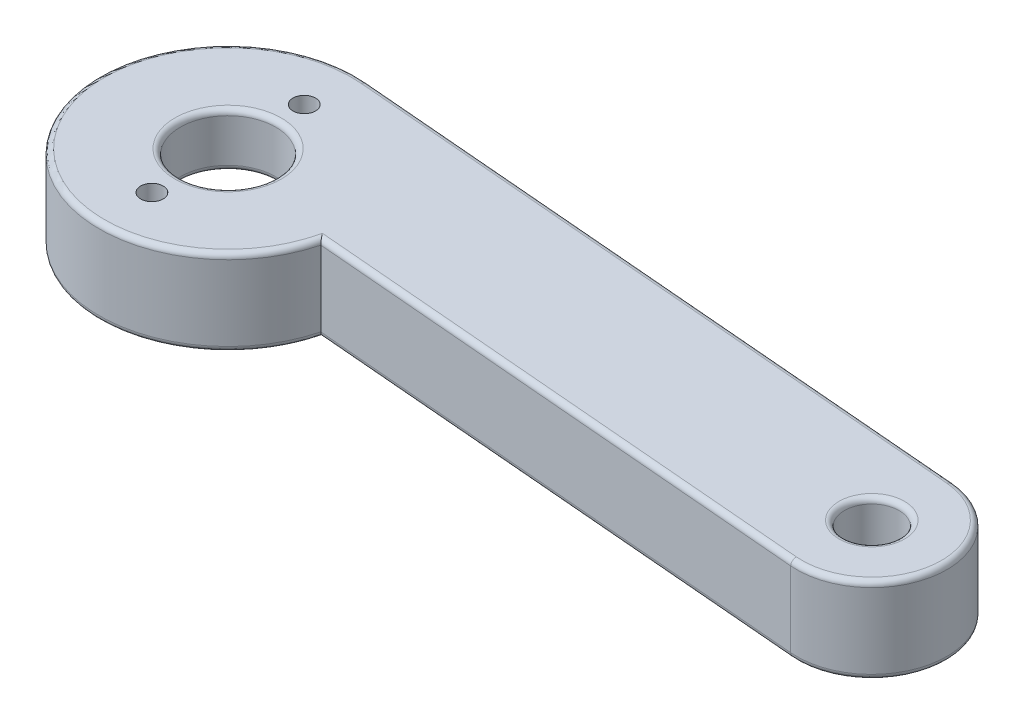
from build123d import *

# Parameters (mm, degrees)
EXTRUDE_1_DEPTH     = 8
SKETCH_2_R          = 10.5
CUT_EXTRUDE_1_DEPTH = 3
SKETCH_3_R          = 4.45
SKETCH_3_R_2        = 1.05
CUT_EXTRUDE_2_DEPTH = 69.249542123
SKETCH_4_R          = 2.55
CUT_EXTRUDE_3_DEPTH = 69.534662763
FILLET_1_R          = 0.5
FILLET_2_R          = 0.5


with BuildPart() as part:
    # 草图1 → 凸台-拉伸1 (new body)
    with BuildSketch(Plane(origin=(0, 0, 0), x_dir=(1, 0, 0), z_dir=(0, 1, 0))):
        with BuildLine():
            Line((1, 11.958260743), (60.583333333, 6.9756521))
            ThreePointArc((60.583333333, 6.9756521), (66.9756521, -0.583333333), (59.416666667, -6.9756521))
            Line((59.416666667, -6.9756521), (11.624337437, -2.979056754))
            ThreePointArc((11.624337437, -2.979056754), (-9.77876973, -6.955261502), (1, 11.958260743))
        make_face()
    extrude(amount=EXTRUDE_1_DEPTH)

    # 草图2 → 切除-拉伸1 (cut)
    with BuildSketch(Plane(origin=(0, 0, 0), x_dir=(1, 0, 0), z_dir=(0, 1, 0))):
        Circle(SKETCH_2_R)
    extrude(amount=CUT_EXTRUDE_1_DEPTH, mode=Mode.SUBTRACT)

    # 草图3 → 切除-拉伸2 (cut, through all)
    with BuildSketch(Plane.XZ.offset(-3)):
        Circle(SKETCH_3_R)
        with Locations((0, -7.1)):
            Circle(SKETCH_3_R_2)
        with Locations((0, 7.1)):
            Circle(SKETCH_3_R_2)
    extrude(amount=-CUT_EXTRUDE_2_DEPTH, mode=Mode.SUBTRACT)

    # 草图4 → 切除-拉伸3 (cut, through all)
    with BuildSketch(Plane.XZ):
        with Locations((60, 0)):
            Circle(SKETCH_4_R)
    extrude(amount=-CUT_EXTRUDE_3_DEPTH, mode=Mode.SUBTRACT)

    # 圆角1
    fillet_1_edges = [part.edges().sort_by_distance(p)[0] for p in [
        (35.520502052, 8, 4.977354427),
        (66.9756521, 8, 0.583333333),
        (30.791666667, 8, -9.466956422),
        (35.520502052, 0, 4.977354427),
        (66.9756521, 0, 0.583333333),
        (-9.77876973, 0, 6.955261502),
        (-9.77876973, 8, 6.955261502),
        (30.791666667, 0, -9.466956422),
    ]]
    fillet(fillet_1_edges, radius=FILLET_1_R)

    # 圆角2
    fillet_2_edges = [part.edges().sort_by_distance(p)[0] for p in [
        (-4.45, 3, 0),
        (-4.45, 8, 0),
        (57.45, 8, 0),
        (57.45, 0, 0),
    ]]
    fillet(fillet_2_edges, radius=FILLET_2_R)


solid = part.part
